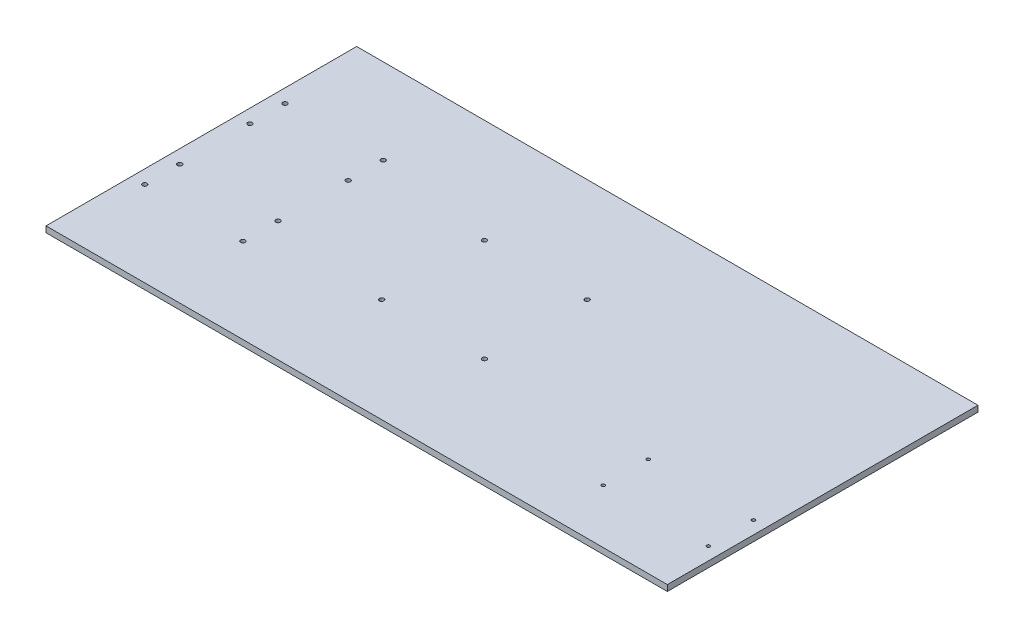
from build123d import *

# Parameters (mm, degrees)
SKETCH_1_W                     = 1240
SKETCH_1_H                     = 620
EXTRUDE_1_DEPTH                = 12
HOPPER_START                   = 6
SKETCH_2_R                     = 4.5
HOPPER_FRAME_HOLES_DEPTH       = 6
DRIVE_START                    = 6
SKETCH_3_R                     = 4.5
DRIVE_MOUNTING_HOLES_DEPTH     = 14
HOLDER_START                   = 6
HOLDER_MOUNTING_HOLES_LAYOUT_R = 3.3
HOLDER_MOUNTING_HOLES_DEPTH    = 6


with BuildPart() as part:
    # 草图1 → 凸台-拉伸1 (new body)
    with BuildSketch(Plane(origin=(0, 0, 0), x_dir=(1, 0, 0), z_dir=(0, 1, 0))):
        with Locations((55, 0)):
            Rectangle(SKETCH_1_W, SKETCH_1_H)
    extrude(amount=EXTRUDE_1_DEPTH)

    # 草图2 → Hopper Frame Holes (cut, symmetric)
    with BuildSketch(Plane(origin=(0, 0, 0), x_dir=(1, 0, 0), z_dir=(0, 1, 0)).offset(HOPPER_START)):
        with Locations(Location((-538, 140, 0), (0, 0, 270))):
            Circle(SKETCH_2_R)
        with Locations(Location((-538, 70, 0), (0, 0, 270))):
            Circle(SKETCH_2_R)
        with Locations(Location((-538, -70, 0), (0, 0, 270))):
            Circle(SKETCH_2_R)
        with Locations(Location((-538, -140, 0), (0, 0, 270))):
            Circle(SKETCH_2_R)
        with Locations(Location((-342, 140, 0), (0, 0, 270))):
            Circle(SKETCH_2_R)
        with Locations(Location((-342, 70, 0), (0, 0, 270))):
            Circle(SKETCH_2_R)
        with Locations(Location((-342, -70, 0), (0, 0, 270))):
            Circle(SKETCH_2_R)
        with Locations(Location((-342, -140, 0), (0, 0, 270))):
            Circle(SKETCH_2_R)
    extrude(amount=HOPPER_FRAME_HOLES_DEPTH, both=True, mode=Mode.SUBTRACT)

    # 草图3 → Drive Mounting Holes (cut, symmetric)
    with BuildSketch(Plane(origin=(0, 0, 0), x_dir=(1, 0, 0), z_dir=(0, 1, 0)).offset(DRIVE_START)):
        with Locations(Location((102.530483272, 102.530483272, 0), (0, 0, 270))):
            Circle(SKETCH_3_R)
        with Locations(Location((-102.530483272, 102.530483272, 0), (0, 0, 270))):
            Circle(SKETCH_3_R)
        with Locations(Location((-102.530483272, -102.530483272, 0), (0, 0, 270))):
            Circle(SKETCH_3_R)
        with Locations(Location((102.530483272, -102.530483272, 0), (0, 0, 270))):
            Circle(SKETCH_3_R)
    extrude(amount=DRIVE_MOUNTING_HOLES_DEPTH, both=True, mode=Mode.SUBTRACT)

    # Holder Mounting Holes Layout → Holder Mounting Holes (cut, symmetric)
    with BuildSketch(Plane(origin=(0, 0, 0), x_dir=(1, 0, 0), z_dir=(0, 1, 0)).offset(HOLDER_START)):
        with Locations(Location((439.4, -202.513078806, 0), (0, 0, 270))):
            Circle(HOLDER_MOUNTING_HOLES_LAYOUT_R)
        with Locations(Location((649.4, -202.513078806, 0), (0, 0, 270))):
            Circle(HOLDER_MOUNTING_HOLES_LAYOUT_R)
        with Locations(Location((439.4, -112.513078806, 0), (0, 0, 270))):
            Circle(HOLDER_MOUNTING_HOLES_LAYOUT_R)
        with Locations(Location((649.4, -112.513078806, 0), (0, 0, 270))):
            Circle(HOLDER_MOUNTING_HOLES_LAYOUT_R)
    extrude(amount=HOLDER_MOUNTING_HOLES_DEPTH, both=True, mode=Mode.SUBTRACT)


solid = part.part
